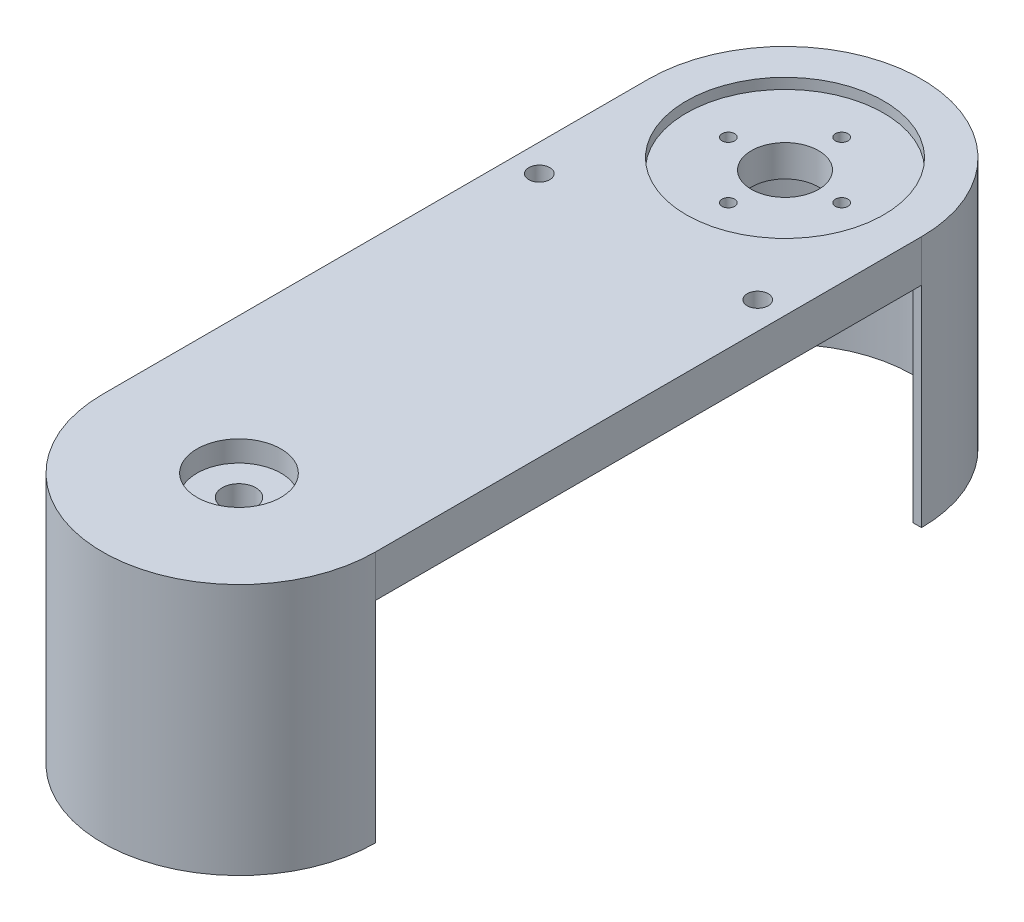
from build123d import *

# Parameters (mm, degrees)
BOSS_EXTRUDE1_DEPTH = 10
SKETCH2_R           = 23.5
CUT_EXTRUDE1_DEPTH  = 2.5
SKETCH4_R           = 8
CUT_EXTRUDE3_DEPTH  = 104.047319228
BOSS_EXTRUDE3_START = 50
BOSS_EXTRUDE3_DEPTH = 50
SKETCH8_R           = 1.5
CUT_EXTRUDE4_DEPTH  = 10
SKETCH9_R           = 4
CUT_EXTRUDE5_DEPTH  = 120.006302354
SKETCH10_R          = 10
CUT_EXTRUDE6_DEPTH  = 5
SKETCH11_R          = 2.5
CUT_EXTRUDE7_DEPTH  = 120.006302354


with BuildPart() as part:
    # Sketch1 → Boss-Extrude1 (new body)
    with BuildSketch(Plane(origin=(0, 0, 0), x_dir=(1, 0, 0), z_dir=(0, 1, 0))):
        with BuildLine():
            Line((-32.5, 65), (-32.5, -65))
            ThreePointArc((-32.5, -65), (0, -97.5), (32.5, -65))
            Line((32.5, -65), (32.5, 65))
            ThreePointArc((32.5, 65), (0, 97.5), (-32.5, 65))
        make_face()
    extrude(amount=BOSS_EXTRUDE1_DEPTH)

    # Sketch2 → Cut-Extrude1 (cut)
    with BuildSketch(Plane(origin=(0, 10, 0), x_dir=(1, 0, 0), z_dir=(0, 1, 0))):
        with Locations(Location((0, 65, 0), (0, 0, 270))):
            Circle(SKETCH2_R)
    extrude(amount=-CUT_EXTRUDE1_DEPTH, mode=Mode.SUBTRACT)

    # Sketch4 → Cut-Extrude3 (cut, through all)
    with BuildSketch(Plane(origin=(0, 7.5, 0), x_dir=(1, 0, 0), z_dir=(0, 1, 0))):
        with Locations(Location((0, 65, 0), (0, 0, 270))):
            Circle(SKETCH4_R)
    extrude(amount=-CUT_EXTRUDE3_DEPTH, mode=Mode.SUBTRACT)

    # Sketch7 → Boss-Extrude3 (add)
    with BuildSketch(Plane.XZ.offset(BOSS_EXTRUDE3_START)):
        with BuildLine():
            Line((-30.5, 65), (-32.5, 65))
            ThreePointArc((-32.5, 65), (0, 97.5), (32.5, 65))
            Line((32.5, 65), (30.5, 65))
            ThreePointArc((30.5, 65), (0, 95.5), (-30.5, 65))
        make_face()
        with BuildLine():
            Line((-32.5, -65), (-30.5, -65))
            ThreePointArc((-30.5, -65), (0, -95.5), (30.5, -65))
            Line((30.5, -65), (32.5, -65))
            ThreePointArc((32.5, -65), (0, -97.5), (-32.5, -65))
        make_face()
    extrude(amount=-BOSS_EXTRUDE3_DEPTH)

    # Sketch8 → Cut-Extrude4 (cut)
    with BuildSketch(Plane(origin=(0, 7.5, 0), x_dir=(1, 0, 0), z_dir=(0, 1, 0))):
        with Locations(Location((13.5, 65, 0), (0, 0, 270))):
            Circle(SKETCH8_R)
        with Locations(Location((0, 78.5, 0), (0, 0, 270))):
            Circle(SKETCH8_R)
        with Locations(Location((-13.5, 65, 0), (0, 0, 270))):
            Circle(SKETCH8_R)
        with Locations(Location((0, 51.5, 0), (0, 0, 270))):
            Circle(SKETCH8_R)
    extrude(amount=-CUT_EXTRUDE4_DEPTH, mode=Mode.SUBTRACT)

    # Sketch9 → Cut-Extrude5 (cut, through all)
    with BuildSketch(Plane(origin=(0, 10, 0), x_dir=(1, 0, 0), z_dir=(0, 1, 0))):
        with Locations(Location((0, -65, 0), (0, 0, 270))):
            Circle(SKETCH9_R)
    extrude(amount=-CUT_EXTRUDE5_DEPTH, mode=Mode.SUBTRACT)

    # Sketch10 → Cut-Extrude6 (cut)
    with BuildSketch(Plane(origin=(0, 10, 0), x_dir=(1, 0, 0), z_dir=(0, 1, 0))):
        with Locations(Location((0, -65, 0), (0, 0, 270))):
            Circle(SKETCH10_R)
    extrude(amount=-CUT_EXTRUDE6_DEPTH, mode=Mode.SUBTRACT)

    # Sketch11 → Cut-Extrude7 (cut, through all)
    with BuildSketch(Plane(origin=(0, 10, 0), x_dir=(1, 0, 0), z_dir=(0, 1, 0))):
        with Locations(Location((-26, 32.5, 0), (0, 0, 270))):
            Circle(SKETCH11_R)
        with Locations(Location((26, 32.5, 0), (0, 0, 270))):
            Circle(SKETCH11_R)
    extrude(amount=-CUT_EXTRUDE7_DEPTH, mode=Mode.SUBTRACT)


solid = part.part
